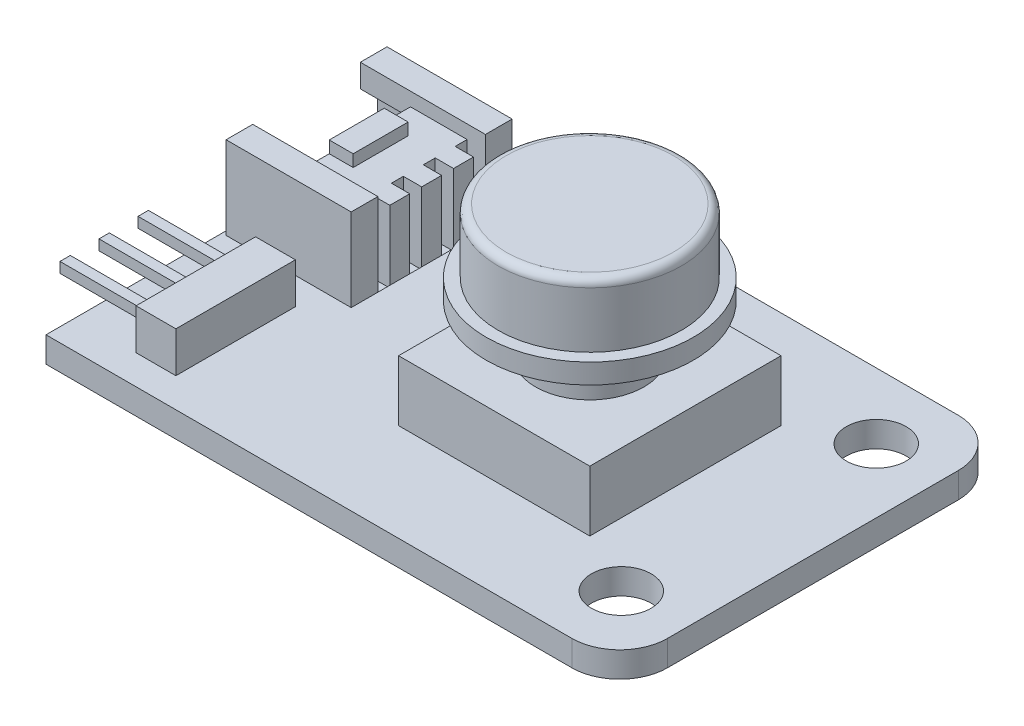
from build123d import *

# Parameters (mm, degrees)
SKETCH1_W            = 36
SKETCH1_H            = 24.25
BOSS_EXTRUDE1_DEPTH  = 1.6
SKETCH2_R            = 1.875
CUT_EXTRUDE1_DEPTH   = 39.020726256
FILLET1_R            = 3
SKETCH3_W            = 12
SKETCH3_H            = 12
BOSS_EXTRUDE2_DEPTH  = 3.8
SKETCH4_R            = 3.4
BOSS_EXTRUDE3_DEPTH  = 3
SKETCH5_R            = 6.5
BOSS_EXTRUDE4_DEPTH  = 1.25
SKETCH6_R            = 5.75
BOSS_EXTRUDE5_DEPTH  = 4
FILLET2_R            = 0.5
SKETCH7_W            = 2.5
SKETCH7_H            = 7.5
BOSS_EXTRUDE6_DEPTH  = 2.55
SKETCH8_W            = 0.65
SKETCH8_H            = 0.65
BOSS_EXTRUDE7_DEPTH  = 5.75
BOSS_EXTRUDE8_DEPTH  = 7.85
CUT_EXTRUDE2_DEPTH   = 6.2
SKETCH11_W           = 3.15
SKETCH11_H           = 6.75
CUT_EXTRUDE3_DEPTH   = 1
SKETCH12_W           = 1.25
SKETCH12_H           = 6.75
CUT_EXTRUDE4_DEPTH   = 0.6
SKETCH13_W           = 1.5
SKETCH13_H           = 3.45
BOSS_EXTRUDE9_DEPTH  = 0.75
SKETCH14_W           = 1.15
SKETCH14_H           = 0.75
CUT_EXTRUDE5_DEPTH   = 4.5
SKETCH15_W           = 1
SKETCH15_H           = 1
BOSS_EXTRUDE10_DEPTH = 1.6
SKETCH16_W           = 0.75
SKETCH16_H           = 0.75
BOSS_EXTRUDE11_DEPTH = 2


with BuildPart() as part:
    # Sketch1 → Boss-Extrude1 (new body)
    with BuildSketch(Plane(origin=(0, 0, 0), x_dir=(1, 0, 0), z_dir=(0, 1, 0))):
        with Locations((18, 0)):
            Rectangle(SKETCH1_W, SKETCH1_H)
    extrude(amount=BOSS_EXTRUDE1_DEPTH)

    # Sketch2 → Cut-Extrude1 (cut, through all)
    with BuildSketch(Plane(origin=(0, 1.6, 0), x_dir=(1, 0, 0), z_dir=(0, 1, 0))):
        with Locations(Location((31.975, 8, 0), (0, 0, 270))):
            Circle(SKETCH2_R)
        with Locations(Location((31.975, -8, 0), (0, 0, 270))):
            Circle(SKETCH2_R)
    extrude(amount=-CUT_EXTRUDE1_DEPTH, mode=Mode.SUBTRACT)

    # Fillet1
    fillet1_edges = [part.edges().sort_by_distance(p)[0] for p in [
        (36, 0.8, -12.125),
        (36, 0.8, 12.125),
    ]]
    fillet(fillet1_edges, radius=FILLET1_R)

    # Sketch3 → Boss-Extrude2 (add)
    with BuildSketch(Plane(origin=(0, 1.6, 0), x_dir=(1, 0, 0), z_dir=(0, 1, 0))):
        with Locations((22, 0)):
            Rectangle(SKETCH3_W, SKETCH3_H)
    extrude(amount=BOSS_EXTRUDE2_DEPTH)

    # Sketch4 → Boss-Extrude3 (add)
    with BuildSketch(Plane(origin=(0, 5.4, 0), x_dir=(1, 0, 0), z_dir=(0, 1, 0))):
        with Locations(Location((22, 0, 0), (0, 0, 270))):
            Circle(SKETCH4_R)
    extrude(amount=BOSS_EXTRUDE3_DEPTH)

    # Sketch5 → Boss-Extrude4 (add)
    with BuildSketch(Plane(origin=(0, 8.4, 0), x_dir=(1, 0, 0), z_dir=(0, 1, 0))):
        with Locations(Location((22, 0, 0), (0, 0, 270))):
            Circle(SKETCH5_R)
    extrude(amount=BOSS_EXTRUDE4_DEPTH)

    # Sketch6 → Boss-Extrude5 (add)
    with BuildSketch(Plane(origin=(0, 9.65, 0), x_dir=(1, 0, 0), z_dir=(0, 1, 0))):
        with Locations(Location((22, 0, 0), (0, 0, 270))):
            Circle(SKETCH6_R)
    extrude(amount=BOSS_EXTRUDE5_DEPTH)

    # Fillet2
    fillet2_edges = [part.edges().sort_by_distance(p)[0] for p in [
        (22, 13.65, -5.75),
    ]]
    fillet(fillet2_edges, radius=FILLET2_R)

    # Sketch7 → Boss-Extrude6 (add)
    with BuildSketch(Plane(origin=(0, 1.6, 0), x_dir=(1, 0, 0), z_dir=(0, 1, 0))):
        with Locations((5.05, -6.525)):
            Rectangle(SKETCH7_W, SKETCH7_H)
    extrude(amount=BOSS_EXTRUDE6_DEPTH)

    # Sketch8 → Boss-Extrude7 (add)
    with BuildSketch(Plane.ZY.offset(-3.8)):
        with Locations((4.075, 2.875)):
            Rectangle(SKETCH8_W, SKETCH8_H)
        with Locations((6.525, 2.875)):
            Rectangle(SKETCH8_W, SKETCH8_H)
        with Locations((8.975, 2.875)):
            Rectangle(SKETCH8_W, SKETCH8_H)
    extrude(amount=BOSS_EXTRUDE7_DEPTH)

    # Sketch9 → Boss-Extrude8 (add)
    with BuildSketch(Plane.ZY.offset(-0.25)):
        Polygon((-9.025, 1.6), (1.075, 1.6), (1.075, 6.8), (-0.6, 6.8), (-0.6, 5.95), (-7.35, 5.95), (-7.35, 6.8), (-9.025, 6.8), align=None)
    extrude(amount=-BOSS_EXTRUDE8_DEPTH)

    # Sketch10 → Cut-Extrude2 (cut)
    with BuildSketch(Plane.ZY.offset(-0.25)):
        Polygon((-8.425, 6.2), (-8.425, 2.2), (0.475, 2.2), (0.475, 6.2), (0, 6.2), (0, 5.35), (-7.95, 5.35), (-7.95, 6.2), align=None)
    extrude(amount=-CUT_EXTRUDE2_DEPTH, mode=Mode.SUBTRACT)

    # Sketch11 → Cut-Extrude3 (cut)
    with BuildSketch(Plane(origin=(0, 5.95, 0), x_dir=(1, 0, 0), z_dir=(0, 1, 0))):
        with Locations((1.825, 3.975)):
            Rectangle(SKETCH11_W, SKETCH11_H)
    extrude(amount=-CUT_EXTRUDE3_DEPTH, mode=Mode.SUBTRACT)

    # Sketch12 → Cut-Extrude4 (cut)
    with BuildSketch(Plane(origin=(0, 2.2, 0), x_dir=(1, 0, 0), z_dir=(0, 1, 0))):
        with Locations((0.875, 3.975)):
            Rectangle(SKETCH12_W, SKETCH12_H)
    extrude(amount=-CUT_EXTRUDE4_DEPTH, mode=Mode.SUBTRACT)

    # Sketch13 → Boss-Extrude9 (add)
    with BuildSketch(Plane(origin=(0, 5.95, 0), x_dir=(1, 0, 0), z_dir=(0, 1, 0))):
        with Locations((4.15, 3.975)):
            Rectangle(SKETCH13_W, SKETCH13_H)
    extrude(amount=BOSS_EXTRUDE9_DEPTH)

    # Sketch14 → Cut-Extrude5 (cut)
    with BuildSketch(Plane(origin=(0, 5.95, 0), x_dir=(1, 0, 0), z_dir=(0, 1, 0))):
        with Locations((7.525, 6.975)):
            Rectangle(SKETCH14_W, SKETCH14_H)
        with Locations((7.525, 4.975)):
            Rectangle(SKETCH14_W, SKETCH14_H)
        with Locations((7.525, 2.975)):
            Rectangle(SKETCH14_W, SKETCH14_H)
        with Locations((7.525, 0.975)):
            Rectangle(SKETCH14_W, SKETCH14_H)
    extrude(amount=-CUT_EXTRUDE5_DEPTH, mode=Mode.SUBTRACT)

    # Sketch15 → Boss-Extrude10 (add)
    with BuildSketch(Plane.XZ):
        with Locations((24.5, -6.1)):
            Rectangle(SKETCH15_W, SKETCH15_H)
        with Locations((19.5, 6.1)):
            Rectangle(SKETCH15_W, SKETCH15_H)
        with Locations((24.5, 6.1)):
            Rectangle(SKETCH15_W, SKETCH15_H)
        with Locations((19.5, -6.1)):
            Rectangle(SKETCH15_W, SKETCH15_H)
    extrude(amount=BOSS_EXTRUDE10_DEPTH)

    # Sketch16 → Boss-Extrude11 (add)
    with BuildSketch(Plane.XZ):
        with Locations((7.625, 8.95)):
            Rectangle(SKETCH16_W, SKETCH16_H)
        with Locations((7.625, 6.45)):
            Rectangle(SKETCH16_W, SKETCH16_H)
        with Locations((7.625, 3.95)):
            Rectangle(SKETCH16_W, SKETCH16_H)
        with Locations((7.625, -0.65)):
            Rectangle(SKETCH16_W, SKETCH16_H)
        with Locations((7.625, -2.8)):
            Rectangle(SKETCH16_W, SKETCH16_H)
        with Locations((7.625, -4.95)):
            Rectangle(SKETCH16_W, SKETCH16_H)
        with Locations((7.625, -7.1)):
            Rectangle(SKETCH16_W, SKETCH16_H)
    extrude(amount=BOSS_EXTRUDE11_DEPTH)


solid = part.part
